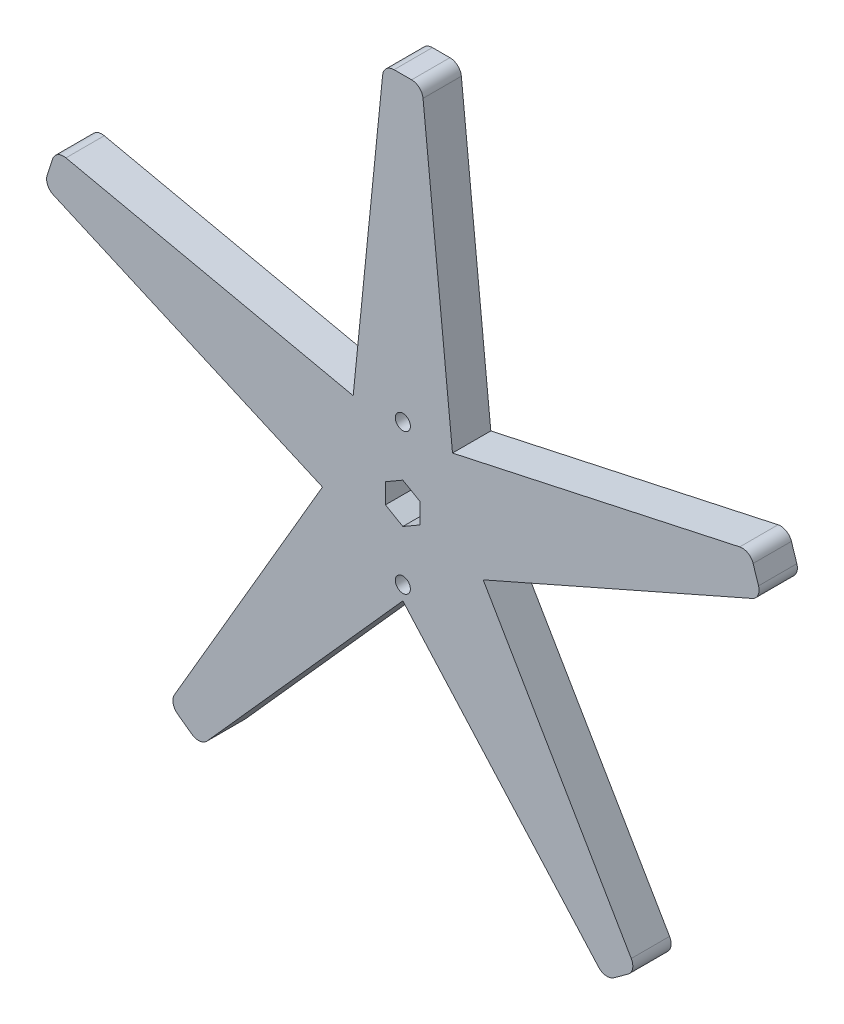
from build123d import *

# Parameters (mm, degrees)
SKETCH1_R           = 2.5
BOSS_EXTRUDE1_DEPTH = 12.7


with BuildPart() as part:
    # Sketch1 → Boss-Extrude1 (new body)
    with BuildSketch(Plane.XY):
        with BuildLine():
            Line((-2.904500288, 123), (2.904500288, 123))
            ThreePointArc((2.904500288, 123), (5.460009841, 122.015857556), (6.695317075, 119.571848255))
            Line((6.695317075, 119.571848255), (16.457987064, 22.652475842))
            Line((16.457987064, 22.652475842), (111.65061869, 43.317358092))
            ThreePointArc((111.65061869, 43.317358092), (114.35674059, 42.897751506), (116.082411555, 40.771434234))
            Line((116.082411555, 40.771434234), (117.877491453, 35.246746383))
            ThreePointArc((117.877491453, 35.246746383), (117.73121225, 32.51219563), (115.788552208, 30.582108227))
            Line((115.788552208, 30.582108227), (26.629582456, -8.652475842))
            Line((26.629582456, -8.652475842), (75.69919429, -92.800248652))
            ThreePointArc((75.69919429, -92.800248652), (76.136362368, -95.503589084), (74.647376125, -97.801867874))
            Line((74.647376125, -97.801867874), (69.947795939, -101.216312743))
            ThreePointArc((69.947795939, -101.216312743), (67.301880867, -101.922215608), (64.865943698, -100.671065923))
            Line((64.865943698, -100.671065923), (0, -28))
            Line((0, -28), (-64.865943698, -100.671065923))
            ThreePointArc((-64.865943698, -100.671065923), (-67.301880867, -101.922215608), (-69.947795939, -101.216312743))
            Line((-69.947795939, -101.216312743), (-74.647376125, -97.801867874))
            ThreePointArc((-74.647376125, -97.801867874), (-76.136362368, -95.503589084), (-75.69919429, -92.800248652))
            Line((-75.69919429, -92.800248652), (-26.629582456, -8.652475842))
            Line((-26.629582456, -8.652475842), (-115.788552208, 30.582108227))
            ThreePointArc((-115.788552208, 30.582108227), (-117.73121225, 32.51219563), (-117.877491453, 35.246746383))
            Line((-117.877491453, 35.246746383), (-116.082411555, 40.771434234))
            ThreePointArc((-116.082411555, 40.771434234), (-114.35674059, 42.897751506), (-111.65061869, 43.317358092))
            Line((-111.65061869, 43.317358092), (-16.457987064, 22.652475842))
            Line((-16.457987064, 22.652475842), (-6.695317075, 119.571848255))
            ThreePointArc((-6.695317075, 119.571848255), (-5.460009841, 122.015857556), (-2.904500288, 123))
        make_face()
        with Locations((0, 23.341182104)):
            Circle(SKETCH1_R, mode=Mode.SUBTRACT)
        with Locations((0, -23.341182104)):
            Circle(SKETCH1_R, mode=Mode.SUBTRACT)
        Polygon((0, -6.65), (5.759068935, -3.325), (5.759068935, 3.325), (0, 6.65), (-5.759068935, 3.325), (-5.759068935, -3.325), align=None, mode=Mode.SUBTRACT)
    extrude(amount=BOSS_EXTRUDE1_DEPTH)


solid = part.part
